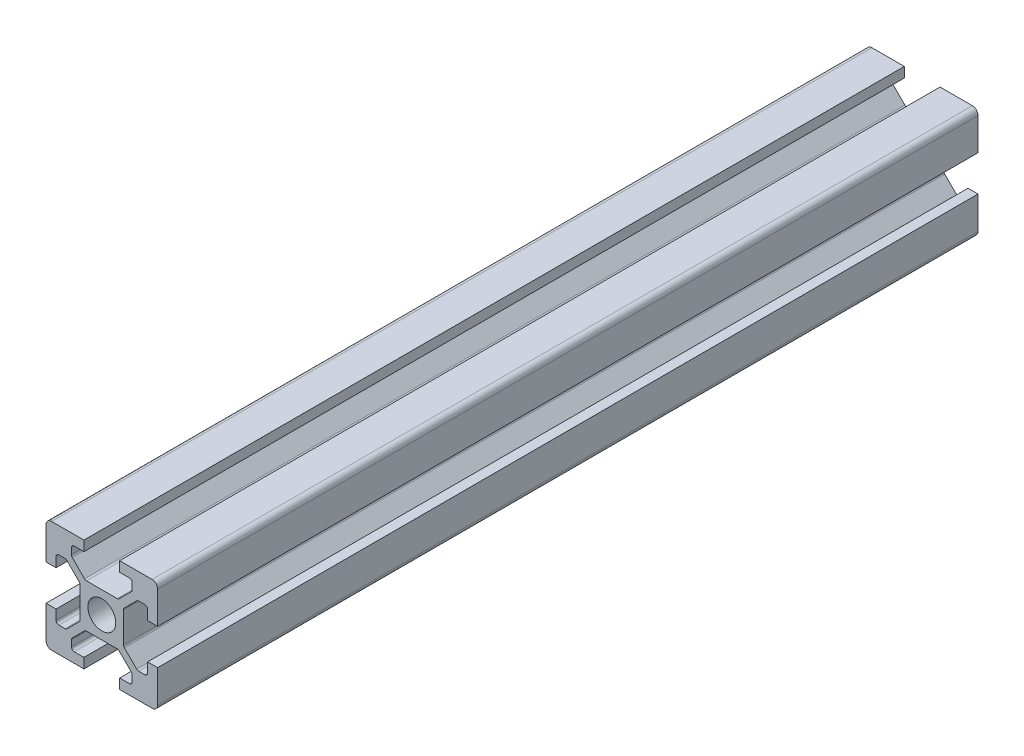
from build123d import *

# Parameters (mm, degrees)
SKETCH1_R           = 2.5
BOSS_EXTRUDE1_DEPTH = 147
FILLET1_R           = 1
FILLET2_R           = 0.5
FILLET3_R           = 0.5
FILLET4_R           = 0.5
FILLET5_R           = 0.5


with BuildPart() as part:
    # Sketch1 → Boss-Extrude1 (new body)
    with BuildSketch(Plane.XY):
        Polygon((13.2, 0), (13.2, 1.8), (15.45, 1.8), (15.45, 3.6), (12.95, 6.1), (7.05, 6.1), (4.55, 3.6), (4.55, 1.8), (6.8, 1.8), (6.8, 0), (0, 0), (0, 6.8), (1.8, 6.8), (1.8, 4.55), (3.6, 4.55), (6.1, 7.05), (6.1, 12.95), (3.6, 15.45), (1.8, 15.45), (1.8, 13.2), (0, 13.2), (0, 20), (6.8, 20), (6.8, 18.2), (4.55, 18.2), (4.55, 16.4), (7.05, 13.9), (12.95, 13.9), (15.45, 16.4), (15.45, 18.2), (13.2, 18.2), (13.2, 20), (20, 20), (20, 13.2), (18.2, 13.2), (18.2, 15.45), (16.4, 15.45), (13.9, 12.95), (13.9, 7.05), (16.4, 4.55), (18.2, 4.55), (18.2, 6.8), (20, 6.8), (20, 0), align=None)
        with Locations((10, 10)):
            Circle(SKETCH1_R, mode=Mode.SUBTRACT)
    extrude(amount=BOSS_EXTRUDE1_DEPTH)

    # Fillet1
    fillet1_edges = [part.edges().sort_by_distance(p)[0] for p in [
        (0, 0, 73.5),
        (0, 20, 73.5),
        (20, 20, 73.5),
        (20, 0, 73.5),
    ]]
    fillet(fillet1_edges, radius=FILLET1_R)

    # Fillet2
    fillet2_edges = [part.edges().sort_by_distance(p)[0] for p in [
        (4.55, 18.2, 73.5),
        (4.55, 16.4, 73.5),
        (7.05, 13.9, 73.5),
        (12.95, 13.9, 73.5),
        (15.45, 16.4, 73.5),
        (15.45, 18.2, 73.5),
    ]]
    fillet(fillet2_edges, radius=FILLET2_R)

    # Fillet3
    fillet3_edges = [part.edges().sort_by_distance(p)[0] for p in [
        (18.2, 15.45, 73.5),
        (16.4, 15.45, 73.5),
        (13.9, 12.95, 73.5),
        (13.9, 7.05, 73.5),
        (16.4, 4.55, 73.5),
        (18.2, 4.55, 73.5),
    ]]
    fillet(fillet3_edges, radius=FILLET3_R)

    # Fillet4
    fillet4_edges = [part.edges().sort_by_distance(p)[0] for p in [
        (1.8, 4.55, 73.5),
        (3.6, 4.55, 73.5),
        (6.1, 7.05, 73.5),
        (6.1, 12.95, 73.5),
        (3.6, 15.45, 73.5),
        (1.8, 15.45, 73.5),
    ]]
    fillet(fillet4_edges, radius=FILLET4_R)

    # Fillet5
    fillet5_edges = [part.edges().sort_by_distance(p)[0] for p in [
        (15.45, 1.8, 73.5),
        (15.45, 3.6, 73.5),
        (12.95, 6.1, 73.5),
        (7.05, 6.1, 73.5),
        (4.55, 3.6, 73.5),
        (4.55, 1.8, 73.5),
    ]]
    fillet(fillet5_edges, radius=FILLET5_R)


solid = part.part
